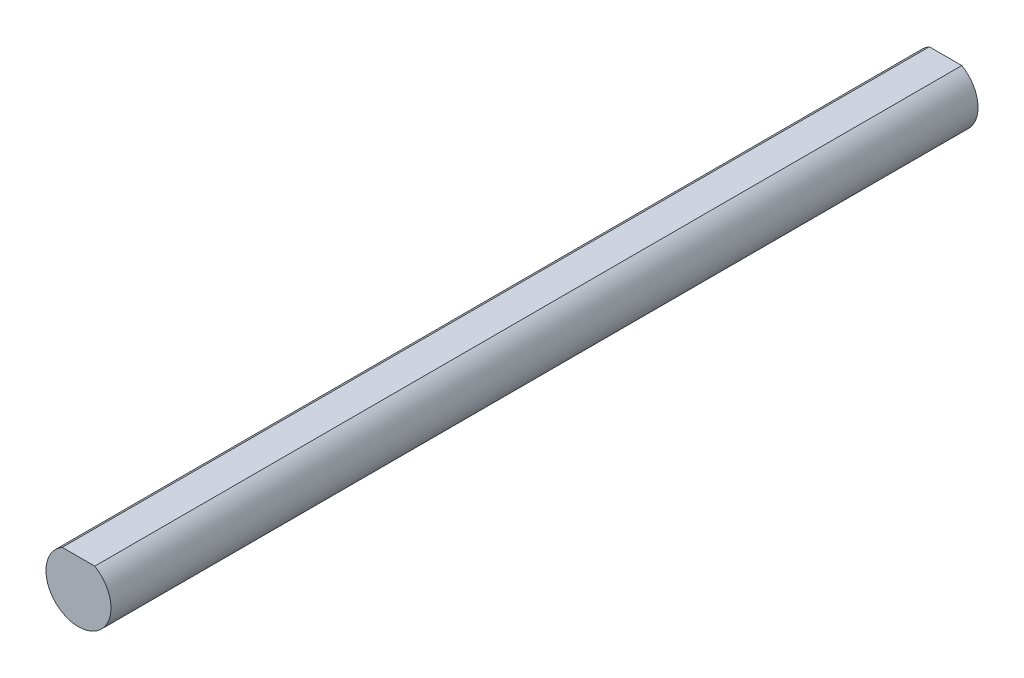
from build123d import *

# Parameters (mm, degrees)
BOSS_EXTRUDE1_DEPTH = 80


with BuildPart() as part:
    # Sketch2 → Boss-Extrude1 (new body)
    with BuildSketch(Plane.XY):
        with BuildLine():
            Line((-1.5, 2.598076211), (1.5, 2.598076211))
            ThreePointArc((1.5, 2.598076211), (0, -3), (-1.5, 2.598076211))
        make_face()
    extrude(amount=BOSS_EXTRUDE1_DEPTH)


solid = part.part
